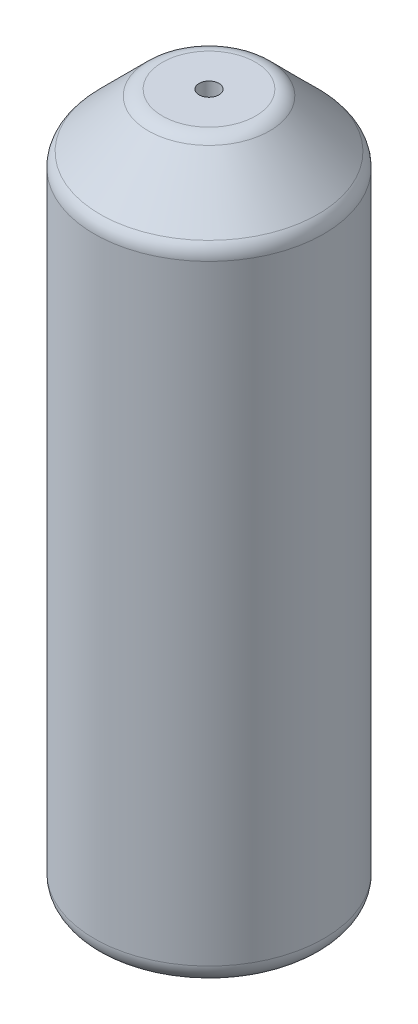
from build123d import *

# Parameters (mm, degrees)
CHAMFER1_SIZE = 3
FILLET1_R     = 1
CHAMFER2_SIZE = 0.5


with BuildPart() as part:
    # Sketch1 → Revolve1 (revolve)
    with BuildSketch(Plane.XY):
        with BuildLine():
            Line((5.75, 0), (5.75, 35))
            Line((5.75, 35), (0.5, 35))
            Line((0.5, 35), (0.5, 33.414213562))
            ThreePointArc((0.5, 33.414213562), (0.576120467, 33.03153013), (0.792893219, 32.707106781))
            Line((0.792893219, 32.707106781), (1.707106781, 31.792893219))
            ThreePointArc((1.707106781, 31.792893219), (1.923879533, 31.46846987), (2, 31.085786438))
            Line((2, 31.085786438), (2, 26))
            ThreePointArc((2, 26), (2.292893219, 25.292893219), (3, 25))
            Line((3, 25), (3.125, 25))
            ThreePointArc((3.125, 25), (3.832106781, 24.707106781), (4.125, 24))
            Line((4.125, 24), (4.125, 0))
            Line((4.125, 0), (5.75, 0))
        make_face()
    revolve(axis=Axis((0, -1000, 0), (0, 1, 0)))

    # Chamfer1
    chamfer1_edges = [part.edges().sort_by_distance(p)[0] for p in [
        (-5.75, 35, 0),
    ]]
    chamfer(chamfer1_edges, length=CHAMFER1_SIZE)

    # Fillet1
    fillet1_edges = [part.edges().sort_by_distance(p)[0] for p in [
        (-5.75, 0, 0),
        (-5.75, 32, 0),
        (-2.75, 35, 0),
    ]]
    fillet(fillet1_edges, radius=FILLET1_R)

    # Chamfer2
    chamfer2_edges = [part.edges().sort_by_distance(p)[0] for p in [
        (-4.125, 0, 0),
    ]]
    chamfer(chamfer2_edges, length=CHAMFER2_SIZE)


solid = part.part
